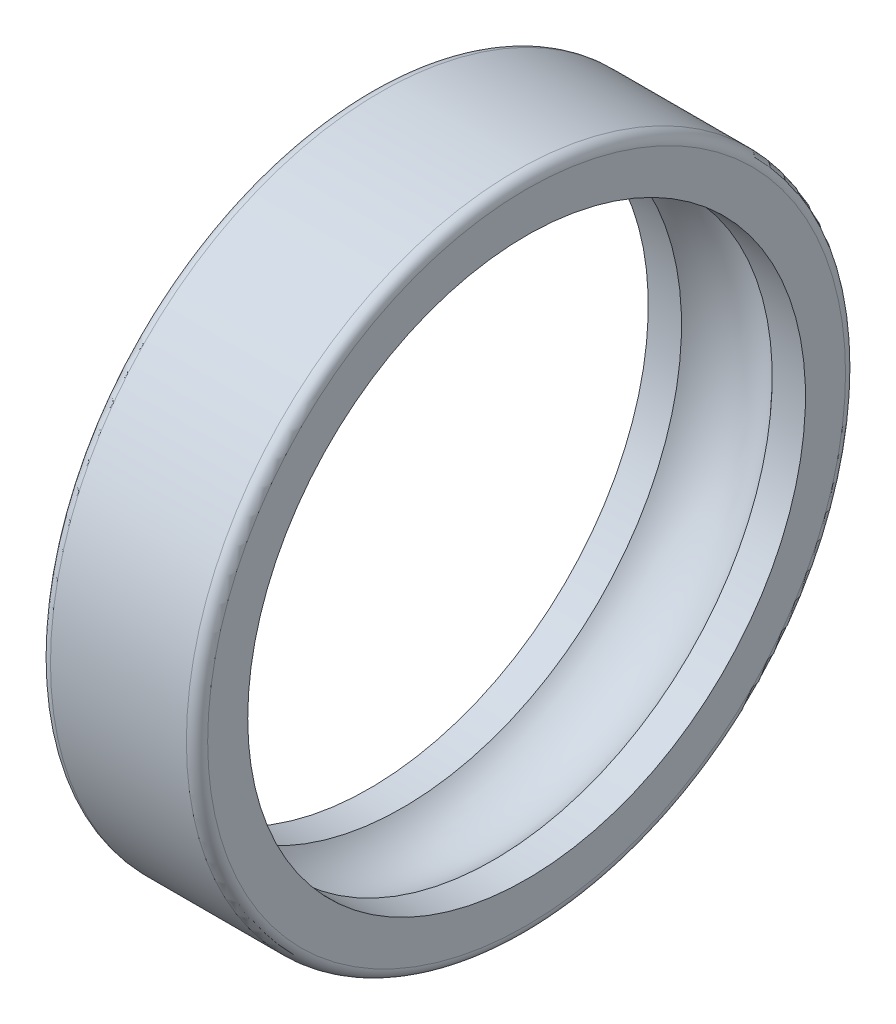
from build123d import *

# Parameters (mm, degrees)
FILLET1_R = 2.1


with BuildPart() as part:
    # Sketch1 → Revolve1 (revolve)
    with BuildSketch(Plane.XY, mode=Mode.PRIVATE) as revolve1_sk:
        with BuildLine():
            Line((-15.5, 65), (15.5, 65))
            Line((15.5, 65), (15.5, 55))
            Line((15.5, 55), (8.94427191, 55))
            ThreePointArc((8.94427191, 55), (0, 59), (-8.94427191, 55))
            Line((-8.94427191, 55), (-15.5, 55))
            Line((-15.5, 55), (-15.5, 65))
        make_face()
    revolve(revolve1_sk.sketch.rotate(Axis((0, 0, 0), (1, 0, 0)), 90), axis=Axis((0, 0, 0), (1, 0, 0)))

    # Fillet1
    fillet1_edges = [part.edges().sort_by_distance(p)[0] for p in [
        (-15.5, 0, -65),
        (15.5, 0, -65),
    ]]
    fillet(fillet1_edges, radius=FILLET1_R)


solid = part.part
